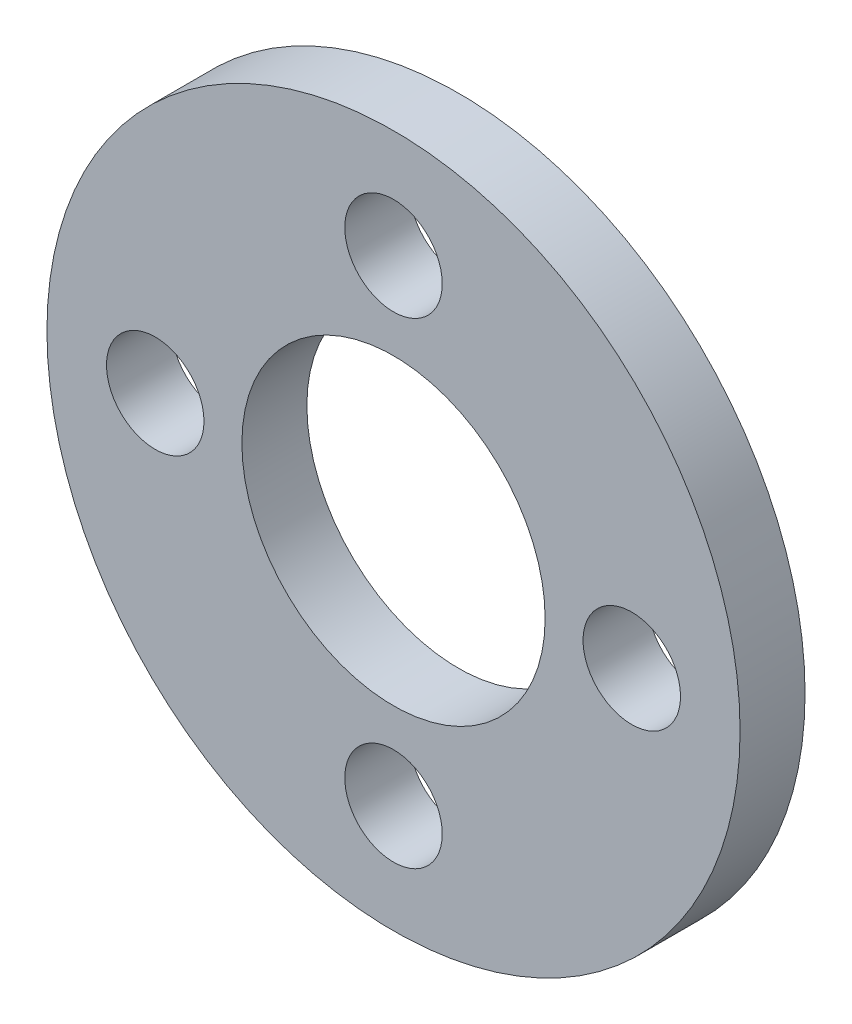
from build123d import *

# Parameters (mm, degrees)
SKETCH1_R           = 16
SKETCH1_R_2         = 7
SKETCH1_R_3         = 2.25
BOSS_EXTRUDE1_DEPTH = 3


with BuildPart() as part:
    # Sketch1 → Boss-Extrude1 (new body)
    with BuildSketch(Plane.XY):
        Circle(SKETCH1_R)
        Circle(SKETCH1_R_2, mode=Mode.SUBTRACT)
        with Locations((11, 0)):
            Circle(SKETCH1_R_3, mode=Mode.SUBTRACT)
        with Locations((0, 11)):
            Circle(SKETCH1_R_3, mode=Mode.SUBTRACT)
        with Locations((-11, 0)):
            Circle(SKETCH1_R_3, mode=Mode.SUBTRACT)
        with Locations((0, -11)):
            Circle(SKETCH1_R_3, mode=Mode.SUBTRACT)
    extrude(amount=BOSS_EXTRUDE1_DEPTH)


solid = part.part
